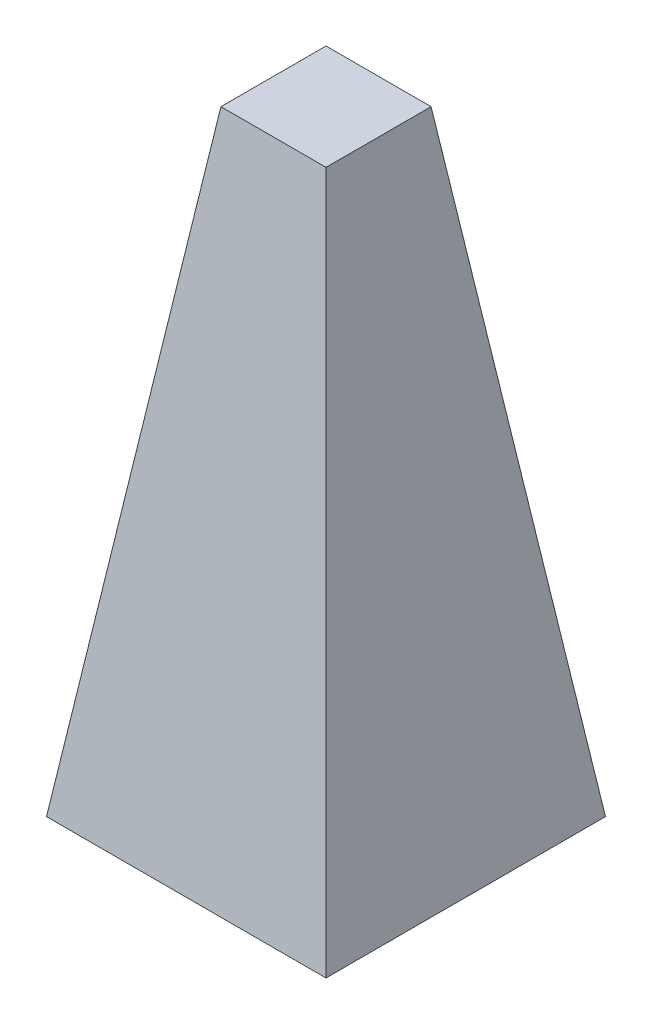
from build123d import *


with BuildPart() as part:
    # Sketch1 → Loft1 section 0
    with BuildSketch(Plane(origin=(0, 0, 0), x_dir=(1, 0, 0), z_dir=(0, 1, 0))):
        with BuildLine():
            Line((-63.5, -63.5), (63.5, -63.5))
            Line((63.5, -63.5), (63.5, 63.5))
            Line((63.5, 63.5), (-63.5, 63.5))
            Line((-63.5, 63.5), (-63.5, -63.5))
        make_face()
    # Sketch2 → Loft1 section 1
    with BuildSketch(Plane(origin=(0, 279.4, 0), x_dir=(1, 0, 0), z_dir=(0, 1, 0))):
        with BuildLine():
            Line((-23.876, -23.876), (23.876, -23.876))
            Line((23.876, -23.876), (23.876, 23.876))
            Line((23.876, 23.876), (-23.876, 23.876))
            Line((-23.876, 23.876), (-23.876, -23.876))
        make_face()
    loft()


solid = part.part
